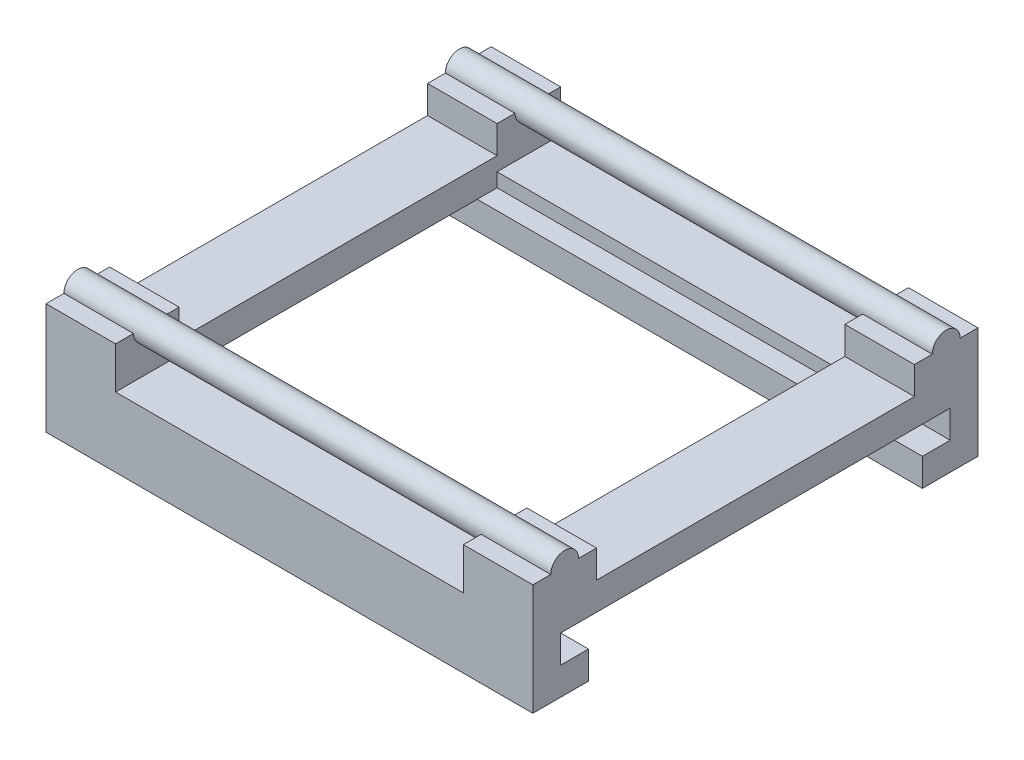
from build123d import *

# Parameters (mm, degrees)
SKETCH_1_W          = 35
SKETCH_1_H          = 32
EXTRUDE_1_DEPTH     = 2
CUT_EXTRUDE_2_DEPTH = 2
SKETCH_3_W          = 35
SKETCH_3_H          = 4
EXTRUDE_2_DEPTH     = 4
SKETCH_4_W          = 35
SKETCH_4_H          = 2
CUT_EXTRUDE_3_DEPTH = 2
SKETCH_5_W          = 35
SKETCH_5_H          = 2
CUT_EXTRUDE_4_DEPTH = 2
SKETCH_6_W          = 5
SKETCH_6_H          = 4.571428571
SKETCH_6_H_2        = 4.571428572
EXTRUDE_3_DEPTH     = 2
SKETCH_7_W          = 25
SKETCH_7_H          = 4.571428572
SKETCH_7_H_2        = 4.571428571
CUT_EXTRUDE_5_DEPTH = 1
SKETCH_9_R          = 1
EXTRUDE_4_DEPTH     = 28
EXTRUDE_START       = -5
SKETCH_9_3_R        = 1
EXTRUDE_5_DEPTH     = 35


with BuildPart() as part:
    # 草图1 → 凸台-拉伸1 (new body)
    with BuildSketch(Plane(origin=(0, 0, 0), x_dir=(1, 0, 0), z_dir=(0, 1, 0))):
        with Locations((-7.669902913, 4.366504854)):
            Rectangle(SKETCH_1_W, SKETCH_1_H)
    extrude(amount=EXTRUDE_1_DEPTH)

    # 草图1<3> → 切除-拉伸2 (cut)
    with BuildSketch(Plane(origin=(0, 0, 0), x_dir=(1, 0, 0), z_dir=(0, 1, 0))):
        Polygon((-7.669902913, 4.366504854), (-20.169902913, 15.795076283), (-20.169902913, -7.062066574), align=None)
        Polygon((4.830097087, 15.795076283), (-20.169902913, 15.795076283), (-7.669902913, 4.366504854), align=None)
        Polygon((4.830097087, 15.795076283), (-7.669902913, 4.366504854), (4.830097087, -7.062066574), align=None)
        Polygon((4.830097087, -7.062066574), (-7.669902913, 4.366504854), (-20.169902913, -7.062066574), align=None)
    extrude(amount=CUT_EXTRUDE_2_DEPTH, mode=Mode.SUBTRACT)

    # 草图3 → 凸台-拉伸2 (add)
    with BuildSketch(Plane.XZ):
        with Locations((-7.669902913, -18.366504854)):
            Rectangle(SKETCH_3_W, SKETCH_3_H)
        with Locations((-7.669902913, 9.633495146)):
            Rectangle(SKETCH_3_W, SKETCH_3_H)
    extrude(amount=EXTRUDE_2_DEPTH)

    # 草图4 → 切除-拉伸3 (cut)
    with BuildSketch(Plane(origin=(0, 0, 7.633495146), x_dir=(-1, 0, 0), z_dir=(0, 0, -1))):
        with Locations((7.669902913, -1)):
            Rectangle(SKETCH_4_W, SKETCH_4_H)
    extrude(amount=-CUT_EXTRUDE_3_DEPTH, mode=Mode.SUBTRACT)

    # 草图5 → 切除-拉伸4 (cut)
    with BuildSketch(Plane.XY.offset(-16.366504854)):
        with Locations((-7.669902913, -1)):
            Rectangle(SKETCH_5_W, SKETCH_5_H)
    extrude(amount=-CUT_EXTRUDE_4_DEPTH, mode=Mode.SUBTRACT)

    # 草图6 → 凸台-拉伸3 (add)
    with BuildSketch(Plane(origin=(0, 2, 0), x_dir=(1, 0, 0), z_dir=(0, 1, 0))):
        with Locations((7.330097087, 18.080790568)):
            Rectangle(SKETCH_6_W, SKETCH_6_H)
        with Locations((7.330097087, -9.34778086)):
            Rectangle(SKETCH_6_W, SKETCH_6_H_2)
        with Locations((-22.669902913, -9.34778086)):
            Rectangle(SKETCH_6_W, SKETCH_6_H_2)
        with Locations((-22.669902913, 18.080790568)):
            Rectangle(SKETCH_6_W, SKETCH_6_H)
    extrude(amount=EXTRUDE_3_DEPTH)

    # 草图7 → 切除-拉伸5 (cut)
    with BuildSketch(Plane(origin=(0, 2, 0), x_dir=(1, 0, 0), z_dir=(0, 1, 0))):
        with Locations((-7.669902913, -9.34778086)):
            Rectangle(SKETCH_7_W, SKETCH_7_H)
        with Locations((-7.669902913, 18.080790568)):
            Rectangle(SKETCH_7_W, SKETCH_7_H_2)
    extrude(amount=-CUT_EXTRUDE_5_DEPTH, mode=Mode.SUBTRACT)

    # 草图9 → 凸台-拉伸4 (add)
    with BuildSketch(Plane(origin=(-20.169902913, 0, 0), x_dir=(0, 0, -1), z_dir=(1, 0, 0))):
        with BuildLine():
            Line((17.080790569, 4), (19.080790569, 4))
            ThreePointArc((19.080790569, 4), (18.080790569, 5), (17.080790569, 4))
        make_face()
        with BuildLine():
            ThreePointArc((17.080790569, 4), (18.080790569, 3), (19.080790569, 4))
            Line((19.080790569, 4), (17.080790569, 4))
        make_face()
        with Locations(Location((-9.34778086, 4, 0), (0, 0, 180))):
            Circle(SKETCH_9_R)
    extrude(amount=EXTRUDE_4_DEPTH)

    # 草图9<3> → 凸台-拉伸5 (add)
    with BuildSketch(Plane(origin=(-20.169902913, 0, 0), x_dir=(0, 0, -1), z_dir=(1, 0, 0)).offset(EXTRUDE_START)):
        with Locations(Location((18.080790569, 4, 0), (0, 0, 180))):
            Circle(SKETCH_9_3_R)
        with Locations(Location((-9.34778086, 4, 0), (0, 0, 180))):
            Circle(SKETCH_9_3_R)
    extrude(amount=EXTRUDE_5_DEPTH)


solid = part.part
